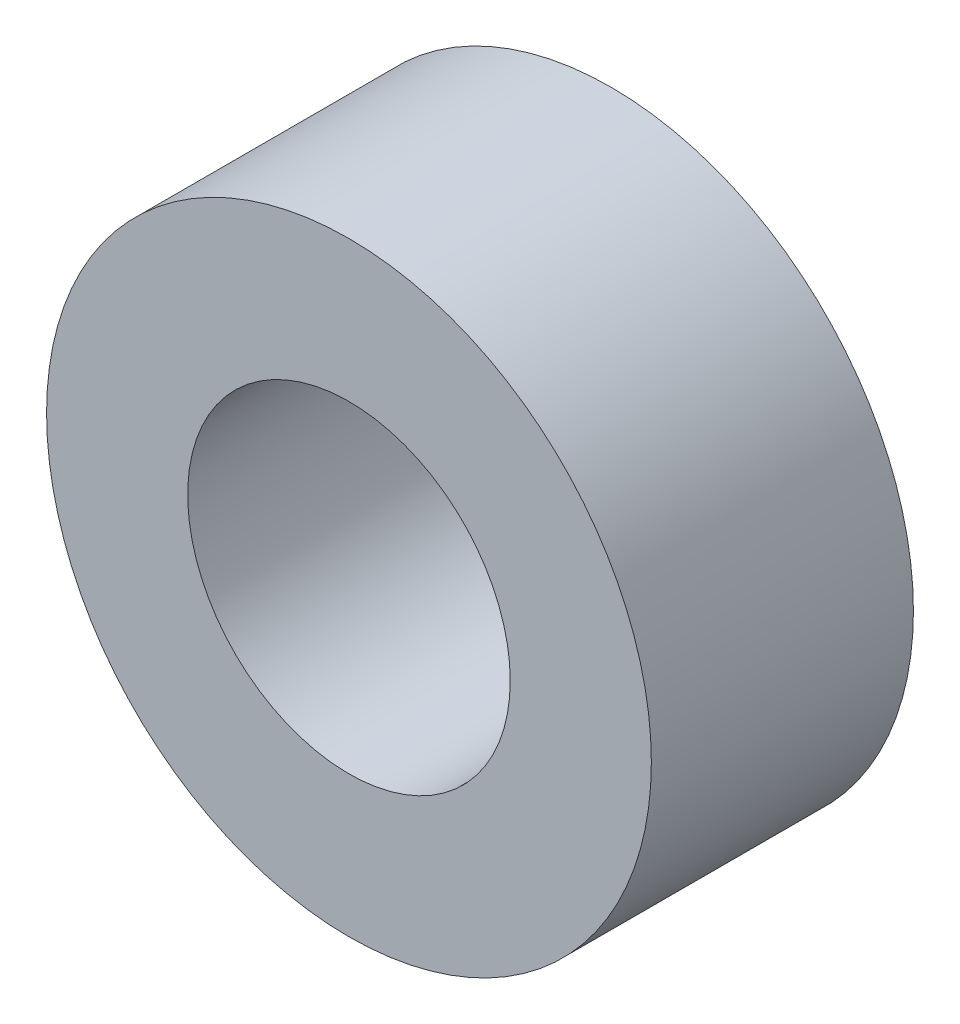
from build123d import *

# Parameters (mm, degrees)
ESQUISSE1_R             = 7.5
BOSS_EXTRU_1_DEPTH      = 6.5
ESQUISSE2_R             = 4
ENL_V_MAT_EXTRU_1_DEPTH = 6.5


with BuildPart() as part:
    # Esquisse1 → Boss.-Extru.1 (new body)
    with BuildSketch(Plane.XY):
        with Locations(Location((0, 0, 0), (0, 0, 180))):
            Circle(ESQUISSE1_R)
    extrude(amount=BOSS_EXTRU_1_DEPTH)

    # Esquisse2 → Enlèv. mat.-Extru.1 (cut)
    with BuildSketch(Plane.XY.offset(6.5)):
        Circle(ESQUISSE2_R)
    extrude(amount=-ENL_V_MAT_EXTRU_1_DEPTH, mode=Mode.SUBTRACT)


solid = part.part
